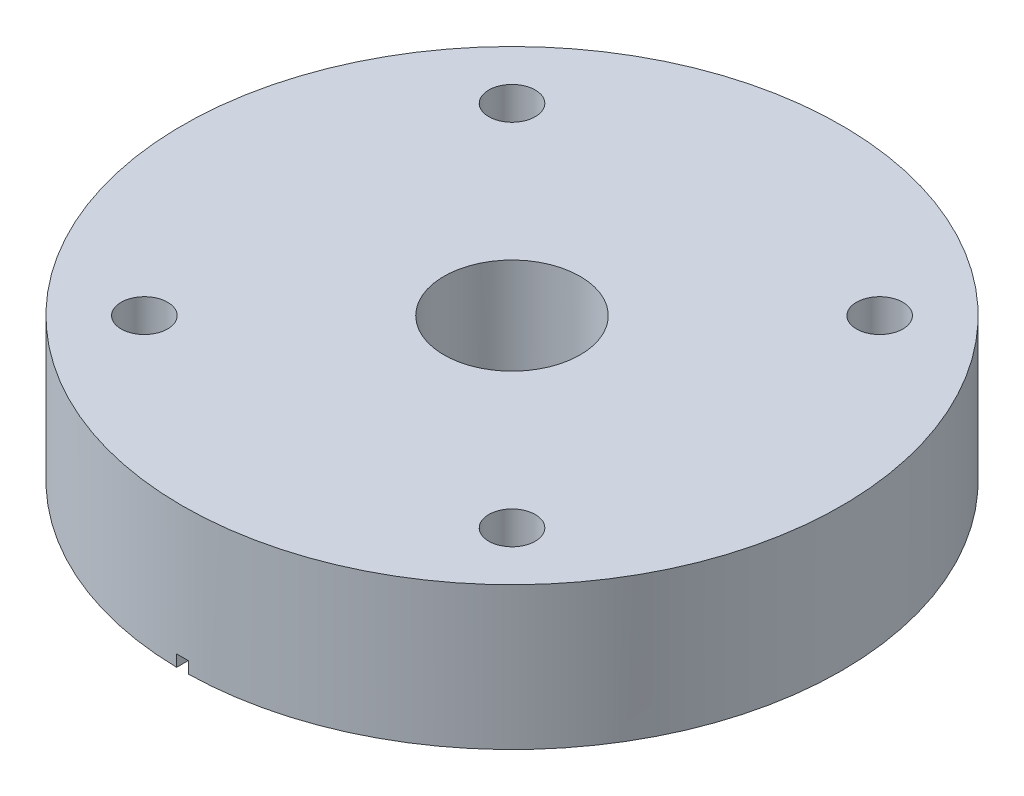
from build123d import *

# Parameters (mm, degrees)
SKETCH1_R                 = 56.35625
SKETCH1_R_2               = 3.96875
SKETCH1_R_3               = 10.1459
BODY_AND_MAIN_HOLES_DEPTH = 24.4122
SKETCH3_R                 = 11.6459
SEAL_BORE_DEPTH           = 22.4122
SKETCH4_W                 = 2
SKETCH4_H                 = 112.7125
VENT_SLOT_DEPTH           = 2


with BuildPart() as part:
    # Sketch1 → body and main holes (new body)
    with BuildSketch(Plane(origin=(0, 0, 0), x_dir=(1, 0, 0), z_dir=(0, 1, 0))):
        with Locations(Location((0, 0, 0), (0, 0, 270))):
            Circle(SKETCH1_R)
        with Locations(Location((-31.430896424, 31.430896424, 0), (0, 0, 270))):
            Circle(SKETCH1_R_2, mode=Mode.SUBTRACT)
        with Locations(Location((31.430896424, 31.430896424, 0), (0, 0, 270))):
            Circle(SKETCH1_R_2, mode=Mode.SUBTRACT)
        with Locations(Location((31.430896424, -31.430896424, 0), (0, 0, 270))):
            Circle(SKETCH1_R_2, mode=Mode.SUBTRACT)
        with Locations(Location((-31.430896424, -31.430896424, 0), (0, 0, 270))):
            Circle(SKETCH1_R_2, mode=Mode.SUBTRACT)
        with Locations(Location((0, 0, 0), (0, 0, 270))):
            Circle(SKETCH1_R_3, mode=Mode.SUBTRACT)
    extrude(amount=BODY_AND_MAIN_HOLES_DEPTH)

    # Sketch3 → seal bore (cut)
    with BuildSketch(Plane.XZ.offset(-24.4122)):
        with Locations(Location((0, 0, 0), (0, 0, 270))):
            Circle(SKETCH3_R)
    extrude(amount=SEAL_BORE_DEPTH, mode=Mode.SUBTRACT)

    # Sketch4 → vent slot (cut)
    with BuildSketch(Plane.XZ):
        Rectangle(SKETCH4_W, SKETCH4_H)
    extrude(amount=-VENT_SLOT_DEPTH, mode=Mode.SUBTRACT)


solid = part.part
